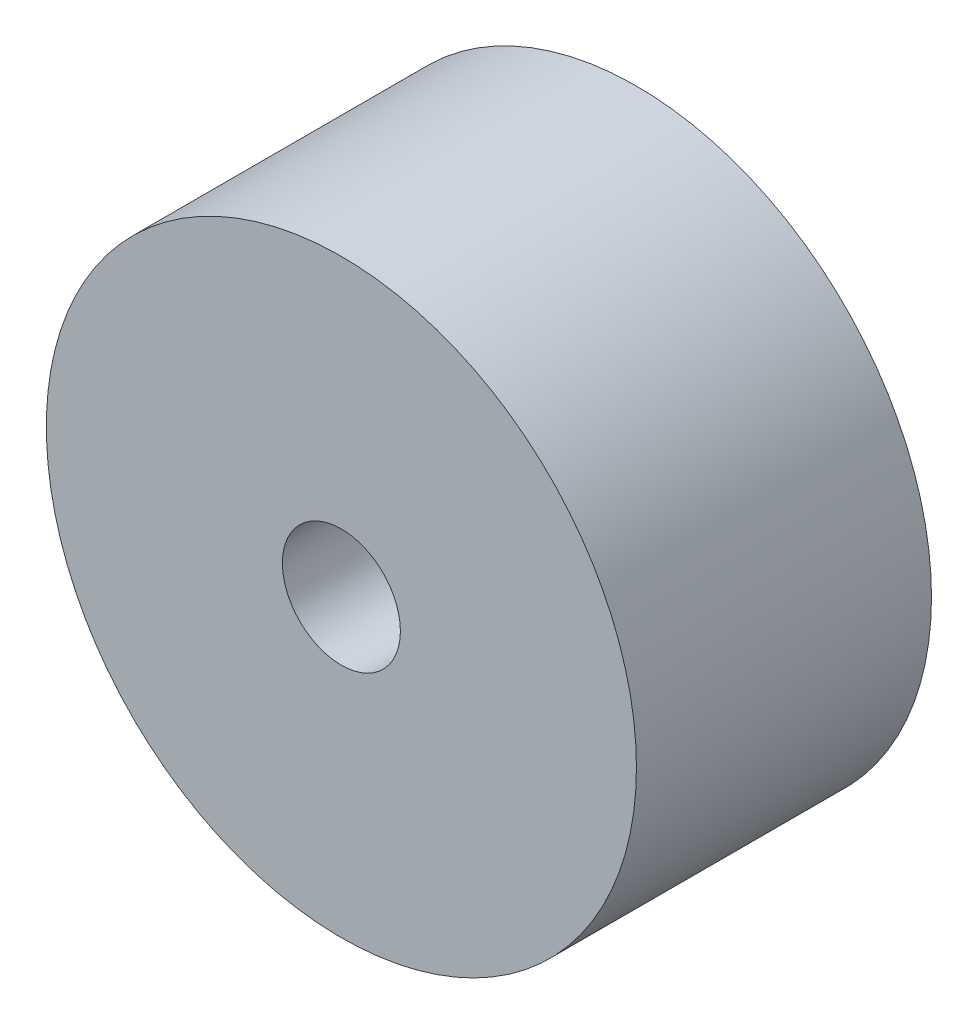
from build123d import *

# Parameters (mm, degrees)
CROQUIS1_R              = 50
CROQUIS1_R_2            = 10
SALIENTE_EXTRUIR1_DEPTH = 50


with BuildPart() as part:
    # Croquis1 → Saliente-Extruir1 (new body)
    with BuildSketch(Plane.XY):
        Circle(CROQUIS1_R)
        Circle(CROQUIS1_R_2, mode=Mode.SUBTRACT)
    extrude(amount=SALIENTE_EXTRUIR1_DEPTH)


solid = part.part
